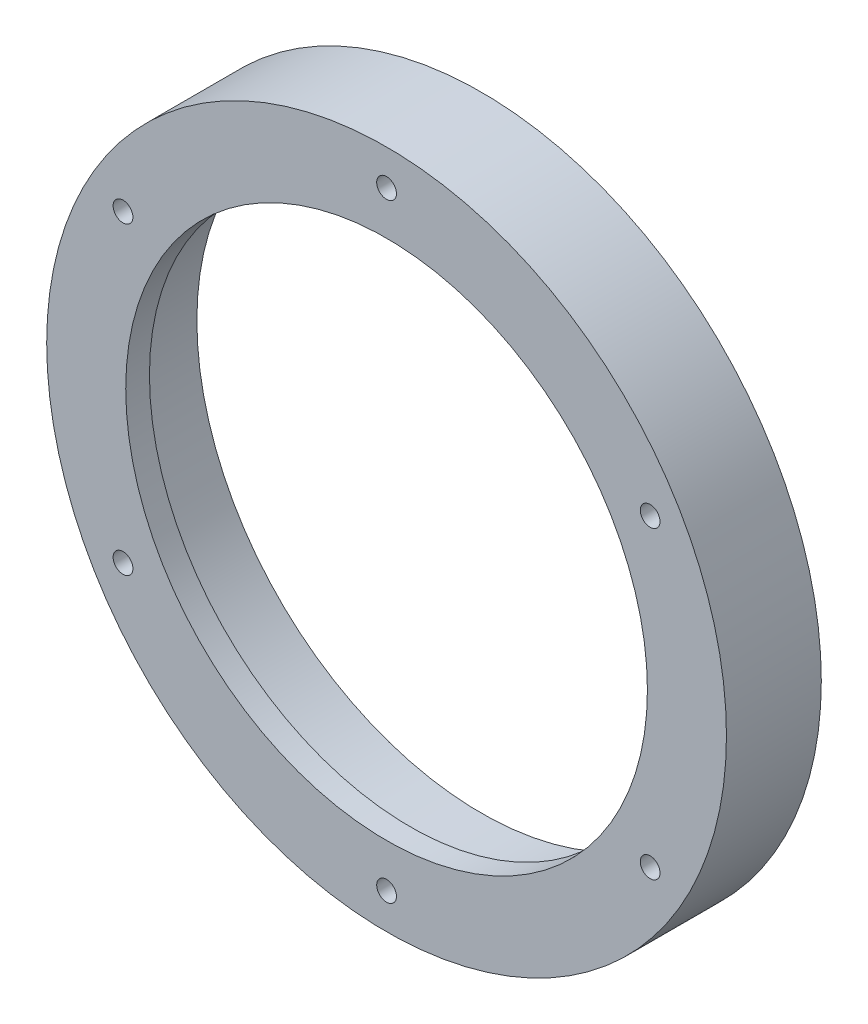
from build123d import *

# Parameters (mm, degrees)
SKETCH_1_R         = 43
SKETCH_1_R_2       = 36
EXTRUDE_1_DEPTH    = 9
SKETCH_2_R         = 43
SKETCH_2_R_2       = 33
EXTRUDE_2_DEPTH    = 3
HOLE_WIZARD_M3_1_D = 2.5


with BuildPart() as part:
    # 草图1 → 凸台-拉伸1 (new body)
    with BuildSketch(Plane.XY):
        Circle(SKETCH_1_R)
        Circle(SKETCH_1_R_2, mode=Mode.SUBTRACT)
    extrude(amount=EXTRUDE_1_DEPTH)

    # 草图2 → 凸台-拉伸2 (add)
    with BuildSketch(Plane.XY.offset(9)):
        Circle(SKETCH_2_R)
        Circle(SKETCH_2_R_2, mode=Mode.SUBTRACT)
    extrude(amount=EXTRUDE_2_DEPTH)

    # M3 螺纹孔1 (through all)
    with Locations(Plane(origin=(-33.341978046, 19.25, 0), x_dir=(-1, 0, 0), z_dir=(0, 0, -1))):
        with Locations((0, 0), (-33.341978046, 19.25), (-66.683956092, 0), (-66.683956092, -38.5), (-33.341978046, -57.75), (0, -38.5)):
            Hole(HOLE_WIZARD_M3_1_D / 2)


solid = part.part
